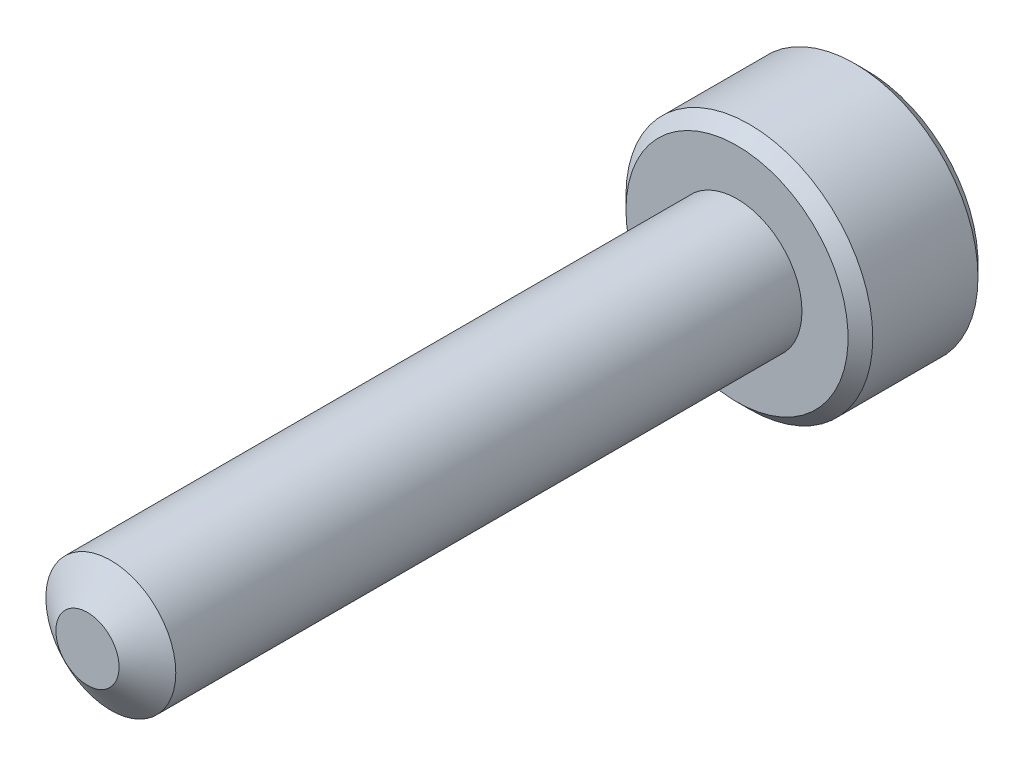
from build123d import *

# Parameters (mm, degrees)
SKETCH1_R          = 1
EXTRUDE1_DEPTH     = 10
SKETCH6_R          = 1.9
EXTRUDE2_DEPTH     = 2
CUT_EXTRUDE1_DEPTH = 1.125
CHAMFER1_SIZE      = 0.19


with BuildPart() as part:
    # Sketch1 → Extrude1 (new body)
    with BuildSketch(Plane.XY):
        Circle(SKETCH1_R)
    extrude(amount=-EXTRUDE1_DEPTH)

    # Sketch4 → Cut-Revolve1 (revolve, cut)
    with BuildSketch(Plane(origin=(0, 0, 0), x_dir=(0, 0, -1), z_dir=(1, 0, 0)), mode=Mode.PRIVATE) as cut_revolve1_sk:
        Polygon((0.35977197, 1), (0, 0.486192379), (0, 1), align=None)
    revolve(cut_revolve1_sk.sketch.rotate(Axis((0, 0, 0), (0, 0, -1)), 90), axis=Axis((0, 0, 0), (0, 0, -1)), mode=Mode.SUBTRACT)

    # Sketch6 → Extrude2 (add)
    with BuildSketch(Plane(origin=(0, 0, -10), x_dir=(-1, 0, 0), z_dir=(0, 0, -1))):
        Circle(SKETCH6_R)
    extrude(amount=EXTRUDE2_DEPTH)

    # Sketch7 → Cut-Extrude1 (cut)
    with BuildSketch(Plane(origin=(0, 0, -12), x_dir=(-1, 0, 0), z_dir=(0, 0, -1))):
        Polygon((0, 0.866025404), (-0.75, 0.433012702), (-0.75, -0.433012702), (0, -0.866025404), (0.75, -0.433012702), (0.75, 0.433012702), align=None)
    extrude(amount=-CUT_EXTRUDE1_DEPTH, mode=Mode.SUBTRACT)

    # Cut-Extrude2 cone 1 section (through the dimple's axis) → Cut-Extrude2 (revolve, cut)
    with BuildSketch(Plane(origin=(0, 0, -12), x_dir=(0, 1, 0), z_dir=(1, 0, 0))):
        Polygon((0, 0), (0.866025404, 0), (0, 0.866025404), align=None)
    revolve(axis=Axis((0, 0, -12), (0, 0, 1)), mode=Mode.SUBTRACT)

    # Chamfer1
    chamfer1_edges = [part.edges().sort_by_distance(p)[0] for p in [
        (1.9, 0, -10),
        (1.9, 0, -12),
    ]]
    chamfer(chamfer1_edges, length=CHAMFER1_SIZE)


solid = part.part
